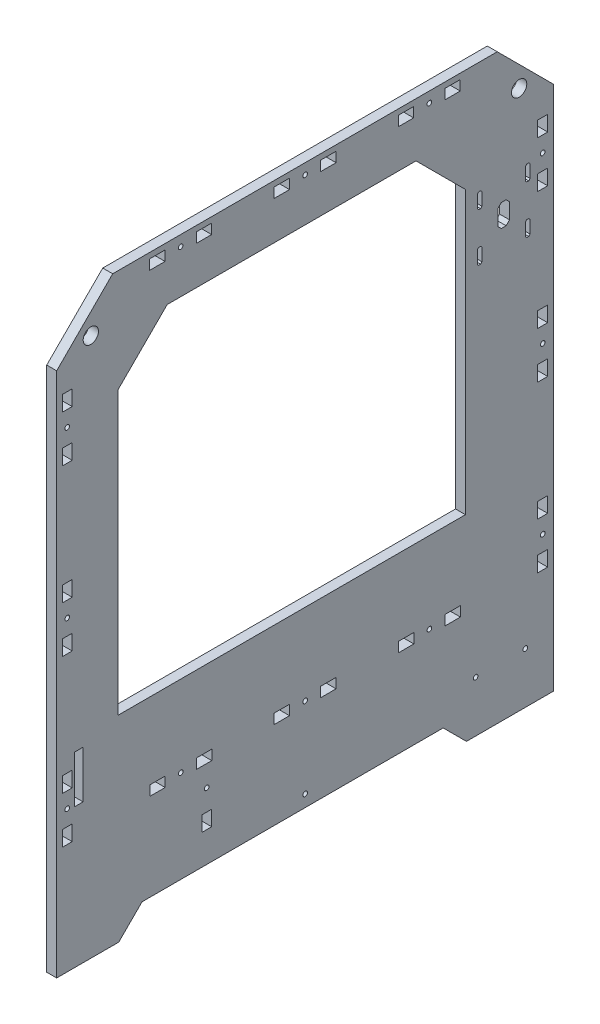
from build123d import *

# Parameters (mm, degrees)
SKETCH1_R           = 1.5
SKETCH1_R_2         = 4.925
SKETCH1_W           = 5.35
SKETCH1_H           = 30.5
SKETCH1_W_2         = 6.4
SKETCH1_H_2         = 9.4
BOSS_EXTRUDE1_DEPTH = 6.4
SKETCH2_R           = 1.5
SKETCH2_W           = 6.4
SKETCH2_H           = 9.9
SKETCH2_W_2         = 9.9
SKETCH2_H_2         = 6.4
SKETCH2_H_3         = 9.8
CUT_EXTRUDE1_DEPTH  = 415.760486883


with BuildPart() as part:
    # Sketch1 → Boss-Extrude1 (new body)
    with BuildSketch(Plane(origin=(0, 0, 0), x_dir=(0, 0, -1), z_dir=(1, 0, 0))):
        Polygon((-37.634998875, 41.275232149), (210.165001125, 41.275232149), (246.265001125, 5.175232149), (246.265001125, -333.674767851), (190.325001125, -333.674767851), (175.325001125, -318.674767851), (-18.721689147, -318.674767851), (-33.721689147, -333.674767851), (-73.734998875, -333.674767851), (-73.734998875, 5.175232149), align=None)
        with Locations((6.165001125, 34.475232149)):
            Circle(SKETCH1_R, mode=Mode.SUBTRACT)
        with Locations((86.365001125, 34.475232149)):
            Circle(SKETCH1_R, mode=Mode.SUBTRACT)
        with Locations((166.365001125, 34.475232149)):
            Circle(SKETCH1_R, mode=Mode.SUBTRACT)
        with Locations((86.365001125, -259.124767851)):
            Circle(SKETCH1_R, mode=Mode.SUBTRACT)
        with Locations((166.465001125, -259.124767851)):
            Circle(SKETCH1_R, mode=Mode.SUBTRACT)
        with Locations((6.265001125, -259.124767851)):
            Circle(SKETCH1_R, mode=Mode.SUBTRACT)
        with Locations((239.465001125, -29.824767851)):
            Circle(SKETCH1_R, mode=Mode.SUBTRACT)
        with Locations((239.465001125, -136.224767851)):
            Circle(SKETCH1_R, mode=Mode.SUBTRACT)
        with Locations((239.465001125, -242.624767851)):
            Circle(SKETCH1_R, mode=Mode.SUBTRACT)
        with Locations((-66.934998875, -242.624767851)):
            Circle(SKETCH1_R, mode=Mode.SUBTRACT)
        with Locations((-66.934998875, -136.224767851)):
            Circle(SKETCH1_R, mode=Mode.SUBTRACT)
        with Locations((-66.934998875, -29.824767851)):
            Circle(SKETCH1_R, mode=Mode.SUBTRACT)
        with Locations((224.265001125, 13.800232149)):
            Circle(SKETCH1_R_2, mode=Mode.SUBTRACT)
        with Locations((-51.734998875, 13.800232149)):
            Circle(SKETCH1_R_2, mode=Mode.SUBTRACT)
        with Locations((228.265001125, -300.824767851)):
            Circle(SKETCH1_R, mode=Mode.SUBTRACT)
        with Locations((196.265001125, -300.824767851)):
            Circle(SKETCH1_R, mode=Mode.SUBTRACT)
        Polygon((-34.371689147, -25.324767851), (-34.371689147, -206.824767851), (189.675001125, -206.824767851), (189.675001125, -25.324767851), (157.825001125, 6.525232149), (-2.521689147, 6.525232149), align=None, mode=Mode.SUBTRACT)
        with Locations((-59.409998875, -228.624767851)):
            Rectangle(SKETCH1_W, SKETCH1_H, mode=Mode.SUBTRACT)
        Polygon((230.451321469, -30.923586412), (229.208680782, -30.923586412), (228.330001125, -31.802266068), (228.330001125, -40.046830544), (229.208680782, -40.925510201), (230.451321469, -40.925510201), (231.330001125, -40.046830544), (231.330001125, -31.802266068), align=None, mode=Mode.SUBTRACT)
        Polygon((215.878301984, -58.680508661), (212.771700266, -58.680508661), (210.575001125, -56.483809519), (210.575001125, -46.377207802), (212.771700266, -44.180508661), (215.878301984, -44.180508661), (218.075001125, -46.377207802), (218.075001125, -56.483809519), align=None, mode=Mode.SUBTRACT)
        Polygon((200.330001125, -31.802266068), (199.451321469, -30.923586412), (198.208680782, -30.923586412), (197.330001125, -31.802266068), (197.330001125, -40.046830544), (198.208680782, -40.925510201), (199.451321469, -40.925510201), (200.330001125, -40.046830544), align=None, mode=Mode.SUBTRACT)
        Polygon((230.451321469, -61.923586412), (229.208680782, -61.923586412), (228.330001125, -62.802266068), (228.330001125, -71.046830544), (229.208680782, -71.925510201), (230.451321469, -71.925510201), (231.330001125, -71.046830544), (231.330001125, -62.802266068), align=None, mode=Mode.SUBTRACT)
        Polygon((199.451321469, -61.923586412), (198.208680782, -61.923586412), (197.330001125, -62.802266068), (197.330001125, -71.046830544), (198.208680782, -71.925510201), (199.451321469, -71.925510201), (200.330001125, -71.046830544), (200.330001125, -62.802266068), align=None, mode=Mode.SUBTRACT)
        with Locations((239.465001125, -44.824767851)):
            Rectangle(SKETCH1_W_2, SKETCH1_H_2, mode=Mode.SUBTRACT)
    extrude(amount=BOSS_EXTRUDE1_DEPTH)

    # Sketch2 → Cut-Extrude1 (cut, through all)
    with BuildSketch(Plane(origin=(6.4, 0, 0), x_dir=(0, 0, -1), z_dir=(1, 0, 0))):
        with Locations((22.965001125, -275.874767851)):
            Circle(SKETCH2_R)
        with Locations((86.365001125, -311.024767851)):
            Circle(SKETCH2_R)
        with Locations((239.465001125, -257.624767851)):
            Rectangle(SKETCH2_W, SKETCH2_H)
        with Locations((239.465001125, -227.624767851)):
            Rectangle(SKETCH2_W, SKETCH2_H)
        with Locations((-66.934998875, -257.624767851)):
            Rectangle(SKETCH2_W, SKETCH2_H)
        with Locations((-66.934998875, -227.624767851)):
            Rectangle(SKETCH2_W, SKETCH2_H)
        with Locations((-66.934998875, -151.224767851)):
            Rectangle(SKETCH2_W, SKETCH2_H)
        with Locations((-66.934998875, -121.224767851)):
            Rectangle(SKETCH2_W, SKETCH2_H)
        with Locations((-66.934998875, -44.824767851)):
            Rectangle(SKETCH2_W, SKETCH2_H)
        with Locations((-66.934998875, -14.824767851)):
            Rectangle(SKETCH2_W, SKETCH2_H)
        with Locations((239.465001125, -121.224767851)):
            Rectangle(SKETCH2_W, SKETCH2_H)
        with Locations((239.465001125, -151.224767851)):
            Rectangle(SKETCH2_W, SKETCH2_H)
        with Locations((239.465001125, -14.824767851)):
            Rectangle(SKETCH2_W, SKETCH2_H)
        with Locations((239.465001125, -44.824767851)):
            Rectangle(SKETCH2_W, SKETCH2_H)
        with Locations((71.365001125, -259.124767851)):
            Rectangle(SKETCH2_W_2, SKETCH2_H_2)
        with Locations((101.365001125, -259.124767851)):
            Rectangle(SKETCH2_W_2, SKETCH2_H_2)
        with Locations((151.465001125, -259.124767851)):
            Rectangle(SKETCH2_W_2, SKETCH2_H_2)
        with Locations((181.465001125, -259.124767851)):
            Rectangle(SKETCH2_W_2, SKETCH2_H_2)
        with Locations((151.365001125, 34.475232149)):
            Rectangle(SKETCH2_W_2, SKETCH2_H_2)
        with Locations((181.365001125, 34.475232149)):
            Rectangle(SKETCH2_W_2, SKETCH2_H_2)
        with Locations((-8.734998875, -259.124767851)):
            Rectangle(SKETCH2_W_2, SKETCH2_H_2)
        with Locations((21.265001125, -259.124767851)):
            Rectangle(SKETCH2_W_2, SKETCH2_H_2)
        with Locations((71.365001125, 34.475232149)):
            Rectangle(SKETCH2_W_2, SKETCH2_H_2)
        with Locations((101.365001125, 34.475232149)):
            Rectangle(SKETCH2_W_2, SKETCH2_H_2)
        with Locations((-8.834998875, 34.475232149)):
            Rectangle(SKETCH2_W_2, SKETCH2_H_2)
        with Locations((21.165001125, 34.475232149)):
            Rectangle(SKETCH2_W_2, SKETCH2_H_2)
        with Locations((22.965001125, -294.324767851)):
            Rectangle(SKETCH2_W, SKETCH2_H_3)
    extrude(amount=-CUT_EXTRUDE1_DEPTH, mode=Mode.SUBTRACT)


solid = part.part
